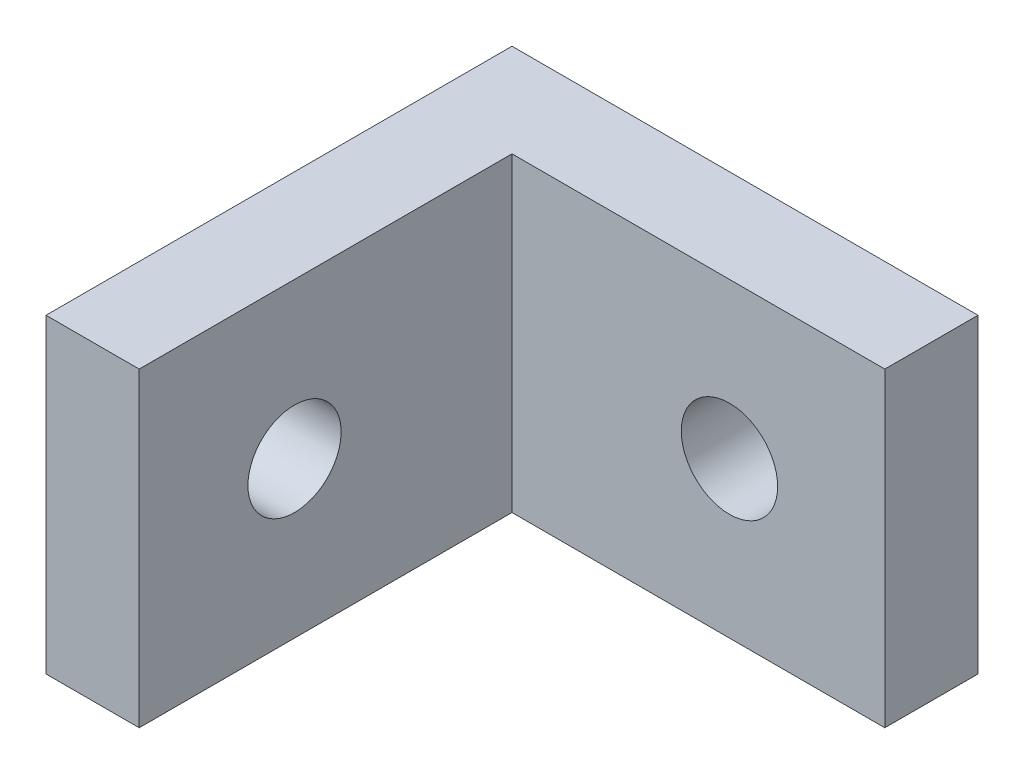
from build123d import *

# Parameters (mm, degrees)
SKETCH_1_W          = 15
SKETCH_1_H          = 10
EXTRUDE_1_DEPTH     = 3
SKETCH_2_W          = 3
SKETCH_2_H          = 10
EXTRUDE_2_DEPTH     = 12
SKETCH_3_R          = 1.55
CUT_EXTRUDE_1_DEPTH = 18.5
SKETCH_4_R          = 1.5
CUT_EXTRUDE_2_DEPTH = 22.794494718


with BuildPart() as part:
    # 草图1 → 凸台-拉伸1 (new body)
    with BuildSketch(Plane.XY):
        Rectangle(SKETCH_1_W, SKETCH_1_H)
    extrude(amount=EXTRUDE_1_DEPTH)

    # 草图2 → 凸台-拉伸2 (add)
    with BuildSketch(Plane.XY.offset(3)):
        with Locations((-6, 0)):
            Rectangle(SKETCH_2_W, SKETCH_2_H)
    extrude(amount=EXTRUDE_2_DEPTH)

    # 草图3 → 切除-拉伸1 (cut, through all)
    with BuildSketch(Plane(origin=(0, 0, 0), x_dir=(-1, 0, 0), z_dir=(0, 0, -1))):
        with Locations((-2.5, 0)):
            Circle(SKETCH_3_R)
    extrude(amount=-CUT_EXTRUDE_1_DEPTH, mode=Mode.SUBTRACT)

    # 草图4 → 切除-拉伸2 (cut, through all)
    with BuildSketch(Plane.ZY.offset(7.5)):
        with Locations((10, 0)):
            Circle(SKETCH_4_R)
    extrude(amount=-CUT_EXTRUDE_2_DEPTH, mode=Mode.SUBTRACT)


solid = part.part
